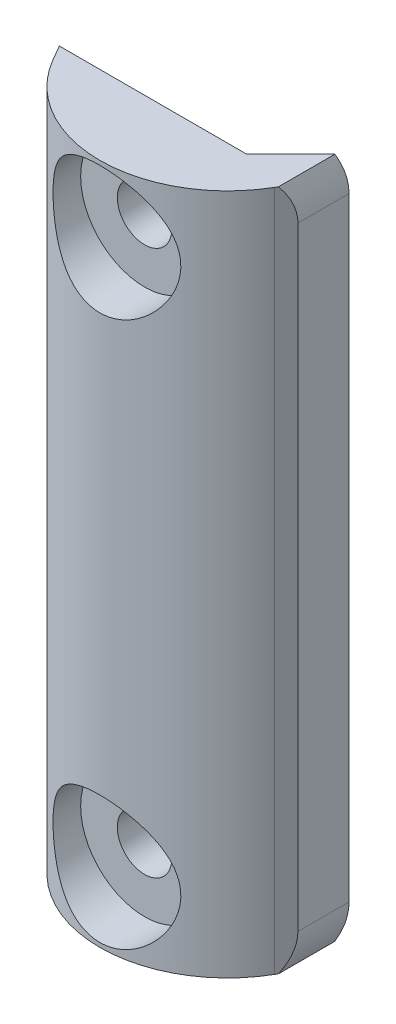
from build123d import *

# Parameters (mm, degrees)
EXTRUDE_1_DEPTH          = 40
CUT_EXTRUDE_1_REACH      = 42.87
CUT_EXTRUDE_1_END_RADIUS = 7.5
SKETCH_3_R               = 1.6
CUT_EXTRUDE_2_REACH      = 44.87
CUT_EXTRUDE_2_END_RADIUS = 7.5
CUT_EXTRUDE_START        = -2
SKETCH_4_R               = 3.75
CUT_EXTRUDE_3_REACH      = 42.87
EXTRUDE_2_REACH          = 43.295
CUT_EXTRUDE_4_REACH      = 42.87


with BuildPart() as part:
    # 草图1 → 凸台-拉伸1 (new body)
    with BuildSketch(Plane(origin=(0, 0, 0), x_dir=(1, 0, 0), z_dir=(0, 1, 0))):
        with BuildLine():
            Line((-6.495190528, -3.75), (-7, -2.875644347))
            Line((-7, -2.875644347), (7, -2.875644347))
            Line((7, -2.875644347), (6.495190528, -3.75))
            ThreePointArc((6.495190528, -3.75), (0, -7.5), (-6.495190528, -3.75))
        make_face()
    extrude(amount=EXTRUDE_1_DEPTH)

    # 切除-拉伸1: up to this cylinder (the profile starts inside it)
    cut_extrude_1_end = Plane(origin=(0, 20, 0), z_dir=(0, -1, 0)) * Cylinder(CUT_EXTRUDE_1_END_RADIUS, 133.74, mode=Mode.PRIVATE)
    # 草图3 → 切除-拉伸1 (cut, up to the surface)
    with BuildSketch(Plane(origin=(0, 0, 2.875644347), x_dir=(-1, 0, 0), z_dir=(0, 0, -1)), mode=Mode.PRIVATE) as cut_extrude_1_sk1:
        with Locations((0, 4)):
            Circle(SKETCH_3_R)
    cut_extrude_1_tool1 = extrude(cut_extrude_1_sk1.sketch, amount=-CUT_EXTRUDE_1_REACH, mode=Mode.PRIVATE) & cut_extrude_1_end
    add(cut_extrude_1_tool1.solids().sort_by_distance((0, 4, 2.875644))[0], mode=Mode.SUBTRACT)
    # 草图3 → 切除-拉伸1 (cut, up to the surface)
    with BuildSketch(Plane(origin=(0, 0, 2.875644347), x_dir=(-1, 0, 0), z_dir=(0, 0, -1)), mode=Mode.PRIVATE) as cut_extrude_1_sk2:
        with Locations((0, 36)):
            Circle(SKETCH_3_R)
    cut_extrude_1_tool2 = extrude(cut_extrude_1_sk2.sketch, amount=-CUT_EXTRUDE_1_REACH, mode=Mode.PRIVATE) & cut_extrude_1_end
    add(cut_extrude_1_tool2.solids().sort_by_distance((0, 36, 2.875644))[0], mode=Mode.SUBTRACT)

    # 切除-拉伸2: up to this cylinder (the profile starts inside it)
    cut_extrude_2_end = Plane(origin=(0, 20, 0), z_dir=(0, -1, 0)) * Cylinder(CUT_EXTRUDE_2_END_RADIUS, 137.74, mode=Mode.PRIVATE)
    # 草图4 → 切除-拉伸2 (cut, up to the surface)
    with BuildSketch(Plane(origin=(0, 0, 2.875644347), x_dir=(-1, 0, 0), z_dir=(0, 0, -1)).offset(CUT_EXTRUDE_START), mode=Mode.PRIVATE) as cut_extrude_2_sk1:
        with Locations((0, 4)):
            Circle(SKETCH_4_R)
    cut_extrude_2_tool1 = extrude(cut_extrude_2_sk1.sketch, amount=-CUT_EXTRUDE_2_REACH, mode=Mode.PRIVATE) & cut_extrude_2_end
    add(cut_extrude_2_tool1.solids().sort_by_distance((0, 4, 4.875644))[0], mode=Mode.SUBTRACT)
    # 草图4 → 切除-拉伸2 (cut, up to the surface)
    with BuildSketch(Plane(origin=(0, 0, 2.875644347), x_dir=(-1, 0, 0), z_dir=(0, 0, -1)).offset(CUT_EXTRUDE_START), mode=Mode.PRIVATE) as cut_extrude_2_sk2:
        with Locations((0, 36)):
            Circle(SKETCH_4_R)
    cut_extrude_2_tool2 = extrude(cut_extrude_2_sk2.sketch, amount=-CUT_EXTRUDE_2_REACH, mode=Mode.PRIVATE) & cut_extrude_2_end
    add(cut_extrude_2_tool2.solids().sort_by_distance((0, 36, 4.875644))[0], mode=Mode.SUBTRACT)

    # 草图6 → 切除-拉伸3 (cut, up to next)
    with BuildSketch(Plane(origin=(0, 0, 2.875644347), x_dir=(-1, 0, 0), z_dir=(0, 0, -1)), mode=Mode.PRIVATE) as cut_extrude_3_sk1:
        with BuildLine():
            Line((-7, 2), (-7, 0))
            Line((-7, 0), (-6.582575695, 0))
            ThreePointArc((-6.582575695, 0), (-6.894531565, 0.978451782), (-7, 2))
        make_face()
    cut_extrude_3_tool1 = extrude(cut_extrude_3_sk1.sketch, amount=-CUT_EXTRUDE_3_REACH, mode=Mode.PRIVATE) & part.part
    # 草图6 → 切除-拉伸3 (cut, up to next)
    with BuildSketch(Plane(origin=(0, 0, 2.875644347), x_dir=(-1, 0, 0), z_dir=(0, 0, -1)), mode=Mode.PRIVATE) as cut_extrude_3_sk2:
        with BuildLine():
            Line((-7, 40), (-6.582575695, 40))
            ThreePointArc((-6.582575695, 40), (-6.894531565, 39.021548218), (-7, 38))
            Line((-7, 38), (-7, 40))
        make_face()
    cut_extrude_3_tool2 = extrude(cut_extrude_3_sk2.sketch, amount=-CUT_EXTRUDE_3_REACH, mode=Mode.PRIVATE) & part.part
    add(cut_extrude_3_tool1.solids().sort_by_distance((6.875723, 0.49573, 2.875644))[0], mode=Mode.SUBTRACT)
    add(cut_extrude_3_tool2.solids().sort_by_distance((6.875723, 39.50427, 2.875644))[0], mode=Mode.SUBTRACT)

    # 凸台-拉伸2: up to this face of the body (flat: up to its plane)
    extrude_2_end = Plane(part.part.faces().sort_by_distance((-0.021956159, 40, 4.788936893))[0])
    # 草图7 → 凸台-拉伸2 (add, up to the picked face)
    with BuildSketch(Plane(origin=(0, 0, 0), x_dir=(1, 0, 0), z_dir=(0, 1, 0)), mode=Mode.PRIVATE) as extrude_2_sk1:
        Polygon((7, -2.875644347), (7, 0.124355653), (4, -2.875644347), align=None)
    extrude_2_tool1 = split(extrude(extrude_2_sk1.sketch, amount=EXTRUDE_2_REACH, mode=Mode.PRIVATE), bisect_by=extrude_2_end, keep=Keep.BOTH, mode=Mode.PRIVATE)
    add(extrude_2_tool1.solids().sort_by(Axis((6, 0, 1.875644), (0, 1, 0)))[0])

    # 切除-拉伸4: up to this plane
    cut_extrude_4_end = Plane(origin=(7, 44.242640687, -0.124355653), z_dir=(0.7071067811865476, 0, 0.7071067811865475))
    # 草图8 → 切除-拉伸4 (cut, up to the surface)
    with BuildSketch(Plane.XY.offset(2.875644347), mode=Mode.PRIVATE) as cut_extrude_4_sk1:
        with BuildLine():
            Line((7, 38), (7, 40))
            Line((7, 40), (6.582575695, 40))
            ThreePointArc((6.582575695, 40), (6.894531565, 39.021548218), (7, 38))
        make_face()
    cut_extrude_4_tool1 = split(extrude(cut_extrude_4_sk1.sketch, amount=-CUT_EXTRUDE_4_REACH, mode=Mode.PRIVATE), bisect_by=cut_extrude_4_end, keep=Keep.BOTH, mode=Mode.PRIVATE)
    add(cut_extrude_4_tool1.solids().sort_by_distance((6.875723, 39.50427, 2.875644))[0], mode=Mode.SUBTRACT)
    # 草图8 → 切除-拉伸4 (cut, up to the surface)
    with BuildSketch(Plane.XY.offset(2.875644347), mode=Mode.PRIVATE) as cut_extrude_4_sk2:
        with BuildLine():
            Line((6.582575695, 0), (7, 0))
            Line((7, 0), (7, 2))
            ThreePointArc((7, 2), (6.894531565, 0.978451782), (6.582575695, 0))
        make_face()
    cut_extrude_4_tool2 = split(extrude(cut_extrude_4_sk2.sketch, amount=-CUT_EXTRUDE_4_REACH, mode=Mode.PRIVATE), bisect_by=cut_extrude_4_end, keep=Keep.BOTH, mode=Mode.PRIVATE)
    add(cut_extrude_4_tool2.solids().sort_by_distance((6.875723, 0.49573, 2.875644))[0], mode=Mode.SUBTRACT)


solid = part.part
